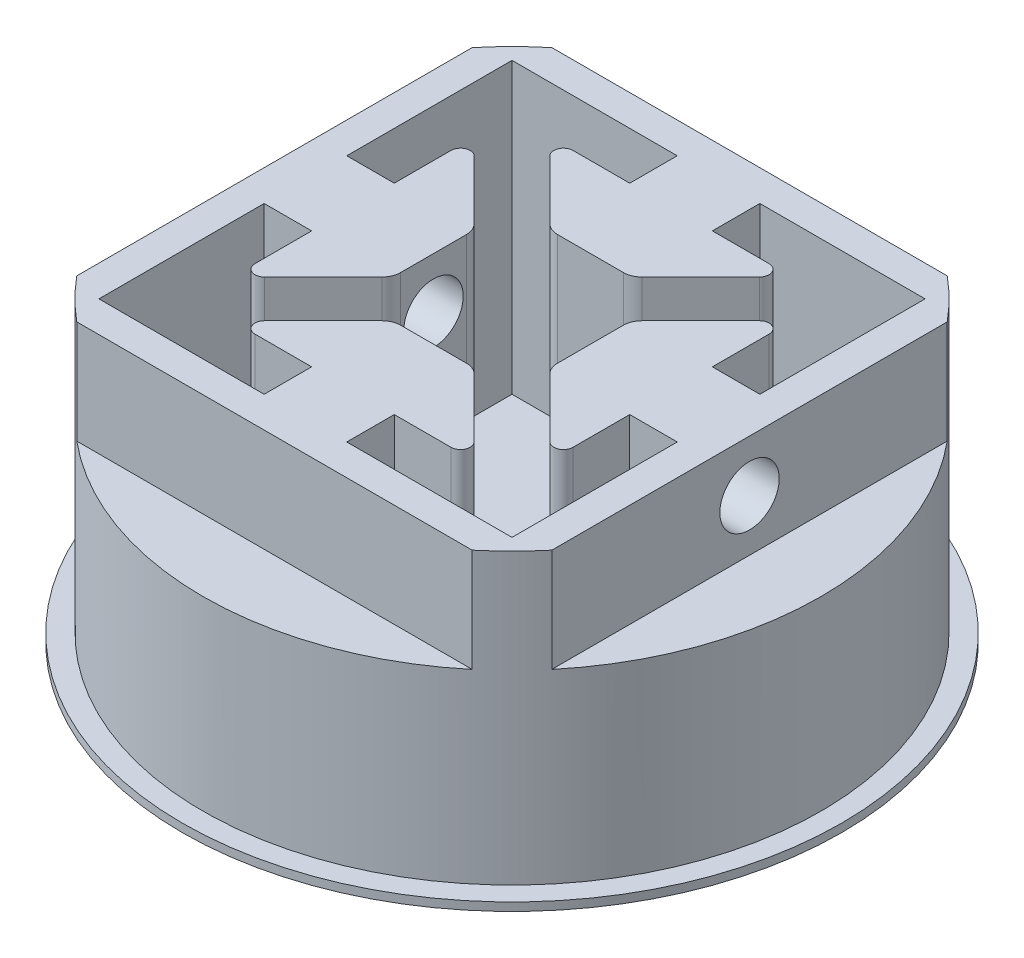
from build123d import *

# Parameters (mm, degrees)
SKIZZE1_R                                   = 29.925
AUFSATZ_LINEAR_AUSTRAGEN1_DEPTH             = 28
SCHNITT_LINEAR_AUSTRAGEN1_REACH             = 68.937
SKIZZE3_R                                   = 2.875
SCHNITT_LINEAR_AUSTRAGEN1_DIRECTION_2_DEPTH = 10
SKIZZE4_W                                   = 59.85
SKIZZE4_H                                   = 10
SCHNITT_LINEAR_AUSTRAGEN2_DEPTH             = 10
KREISMUSTER1_COUNT                          = 2
KREISMUSTER2_COUNT                          = 4
SKIZZE5_R                                   = 31.925
AUFSATZ_LINEAR_AUSTRAGEN2_DEPTH             = 0.8


with BuildPart() as part:
    # Skizze1 → Aufsatz-Linear austragen1 (new body)
    with BuildSketch(Plane(origin=(0, 0, 0), x_dir=(1, 0, 0), z_dir=(0, 1, 0))):
        Circle(SKIZZE1_R)
        with BuildLine():
            Line((-4, -20), (-20, -20))
            Line((-20, -20), (-20, -4))
            Line((-20, -4), (-15.4, -4))
            Line((-15.4, -4), (-15.4, -9.488825196))
            ThreePointArc((-15.4, -9.488825196), (-14.826178869, -10.347609207), (-13.813174058, -10.146110022))
            Line((-13.813174058, -10.146110022), (-8.12603127, -4.458967234))
            ThreePointArc((-8.12603127, -4.458967234), (-7.736711073, -3.876308384), (-7.6, -3.189015407))
            Line((-7.6, -3.189015407), (-7.6, 3.189015407))
            ThreePointArc((-7.6, 3.189015407), (-7.736711073, 3.876308384), (-8.12603127, 4.458967234))
            Line((-8.12603127, 4.458967234), (-13.813174058, 10.146110022))
            ThreePointArc((-13.813174058, 10.146110022), (-14.826178869, 10.347609207), (-15.4, 9.488825196))
            Line((-15.4, 9.488825196), (-15.4, 4))
            Line((-15.4, 4), (-20, 4))
            Line((-20, 4), (-20, 20))
            Line((-20, 20), (-4, 20))
            Line((-4, 20), (-4, 15.4))
            Line((-4, 15.4), (-9.488825196, 15.4))
            ThreePointArc((-9.488825196, 15.4), (-10.347609207, 14.826178869), (-10.146110022, 13.813174058))
            Line((-10.146110022, 13.813174058), (-4.458967234, 8.12603127))
            ThreePointArc((-4.458967234, 8.12603127), (-3.876308384, 7.736711073), (-3.189015407, 7.6))
            Line((-3.189015407, 7.6), (3.189015407, 7.6))
            ThreePointArc((3.189015407, 7.6), (3.876308384, 7.736711073), (4.458967234, 8.12603127))
            Line((4.458967234, 8.12603127), (10.146110022, 13.813174058))
            ThreePointArc((10.146110022, 13.813174058), (10.347609207, 14.826178869), (9.488825196, 15.4))
            Line((9.488825196, 15.4), (4, 15.4))
            Line((4, 15.4), (4, 20))
            Line((4, 20), (20, 20))
            Line((20, 20), (20, 4))
            Line((20, 4), (15.4, 4))
            Line((15.4, 4), (15.4, 9.488825196))
            ThreePointArc((15.4, 9.488825196), (14.826178869, 10.347609207), (13.813174058, 10.146110022))
            Line((13.813174058, 10.146110022), (8.12603127, 4.458967234))
            ThreePointArc((8.12603127, 4.458967234), (7.736711073, 3.876308384), (7.6, 3.189015407))
            Line((7.6, 3.189015407), (7.6, -3.189015407))
            ThreePointArc((7.6, -3.189015407), (7.736711073, -3.876308384), (8.12603127, -4.458967234))
            Line((8.12603127, -4.458967234), (13.813174058, -10.146110022))
            ThreePointArc((13.813174058, -10.146110022), (14.826178869, -10.347609207), (15.4, -9.488825196))
            Line((15.4, -9.488825196), (15.4, -4))
            Line((15.4, -4), (20, -4))
            Line((20, -4), (20, -20))
            Line((20, -20), (4, -20))
            Line((4, -20), (4, -15.4))
            Line((4, -15.4), (9.488825196, -15.4))
            ThreePointArc((9.488825196, -15.4), (10.347609207, -14.826178869), (10.146110022, -13.813174058))
            Line((10.146110022, -13.813174058), (4.458967234, -8.12603127))
            ThreePointArc((4.458967234, -8.12603127), (3.876308384, -7.736711073), (3.189015407, -7.6))
            Line((3.189015407, -7.6), (-3.189015407, -7.6))
            ThreePointArc((-3.189015407, -7.6), (-3.876308384, -7.736711073), (-4.458967234, -8.12603127))
            Line((-4.458967234, -8.12603127), (-10.146110022, -13.813174058))
            ThreePointArc((-10.146110022, -13.813174058), (-10.347609207, -14.826178869), (-9.488825196, -15.4))
            Line((-9.488825196, -15.4), (-4, -15.4))
            Line((-4, -15.4), (-4, -20))
        make_face(mode=Mode.SUBTRACT)
    extrude(amount=AUFSATZ_LINEAR_AUSTRAGEN1_DEPTH)

    # Skizze3 → Schnitt-Linear austragen1 (cut, up to next)
    with BuildSketch(Plane.ZY.offset(-23), mode=Mode.PRIVATE) as schnitt_linear_austragen1_sk1:
        with Locations((0, 23)):
            Circle(SKIZZE3_R)
    schnitt_linear_austragen1_tool1 = extrude(schnitt_linear_austragen1_sk1.sketch, amount=SCHNITT_LINEAR_AUSTRAGEN1_REACH, mode=Mode.PRIVATE) & part.part
    schnitt_linear_austragen1 = schnitt_linear_austragen1_tool1.solids().sort_by_distance((23, 23, 0))[0]
    add(schnitt_linear_austragen1, mode=Mode.SUBTRACT)

    # Skizze3 → Schnitt-Linear austragen1 direction 2 (cut)
    with BuildSketch(Plane.ZY.offset(-23)):
        with Locations((0, 23)):
            Circle(SKIZZE3_R)
    schnitt_linear_austragen1_direction_2 = extrude(amount=-SCHNITT_LINEAR_AUSTRAGEN1_DIRECTION_2_DEPTH, mode=Mode.SUBTRACT)

    # Skizze4 → Schnitt-Linear austragen2 (cut)
    with BuildSketch(Plane.ZY.offset(-23)):
        with Locations((0, 23)):
            Rectangle(SKIZZE4_W, SKIZZE4_H)
    schnitt_linear_austragen2 = extrude(amount=-SCHNITT_LINEAR_AUSTRAGEN2_DEPTH, mode=Mode.SUBTRACT)

    # Kreismuster1: Schnitt-Linear austragen1, Schnitt-Linear austragen1 direction 2 ×2 about axis
    kreismuster1_axis = Axis((0, 28, 0), (0, -1, 0))
    add([schnitt_linear_austragen1.rotate(kreismuster1_axis, i * 360 / KREISMUSTER1_COUNT) for i in range(1, KREISMUSTER1_COUNT)], mode=Mode.SUBTRACT)
    add([schnitt_linear_austragen1_direction_2.rotate(kreismuster1_axis, i * 360 / KREISMUSTER1_COUNT) for i in range(1, KREISMUSTER1_COUNT)], mode=Mode.SUBTRACT)

    # Kreismuster2: Schnitt-Linear austragen2 ×4 about axis
    kreismuster2_axis = Axis((0, 28, 0), (0, -1, 0))
    for i in range(1, KREISMUSTER2_COUNT):
        add(schnitt_linear_austragen2.rotate(kreismuster2_axis, i * 360 / KREISMUSTER2_COUNT), mode=Mode.SUBTRACT)

    # Skizze5 → Aufsatz-Linear austragen2 (add)
    with BuildSketch(Plane.XZ):
        Circle(SKIZZE5_R)
    extrude(amount=AUFSATZ_LINEAR_AUSTRAGEN2_DEPTH)


solid = part.part
